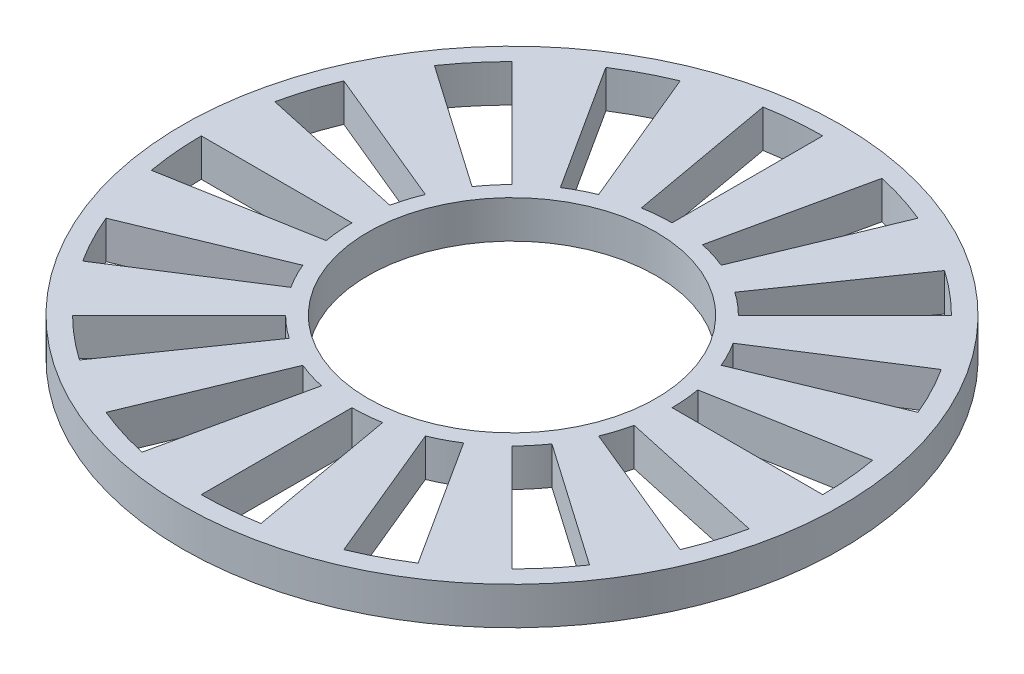
from build123d import *

# Parameters (mm, degrees)
SKETCH3_R           = 17.5
SKETCH3_R_2         = 7.65
BOSS_EXTRUDE2_DEPTH = 2
CUT_EXTRUDE1_DEPTH  = 10
CIRPATTERN1_COUNT   = 16


with BuildPart() as part:
    # Sketch3 → Boss-Extrude2 (new body)
    with BuildSketch(Plane(origin=(0, 0, 0), x_dir=(1, 0, 0), z_dir=(0, 1, 0))):
        with Locations(Location((0, 0, 0), (0, 0, 270))):
            Circle(SKETCH3_R)
        with Locations(Location((0, 0, 0), (0, 0, 270))):
            Circle(SKETCH3_R_2, mode=Mode.SUBTRACT)
    extrude(amount=BOSS_EXTRUDE2_DEPTH)

    # Sketch4 → Cut-Extrude1 (cut)
    with BuildSketch(Plane(origin=(0, 2, 0), x_dir=(1, 0, 0), z_dir=(0, 1, 0))):
        with BuildLine():
            Line((1.5, -8.366600265), (2.911764706, -16.241047574))
            ThreePointArc((2.911764706, -16.241047574), (1.461628378, -16.435134392), (0, -16.5))
            Line((0, -16.5), (0, -8.5))
            ThreePointArc((0, -8.5), (0.752960074, -8.466584384), (1.5, -8.366600265))
        make_face()
    cut_extrude1 = extrude(amount=-CUT_EXTRUDE1_DEPTH, mode=Mode.SUBTRACT)

    # CirPattern1: Cut-Extrude1 ×16 about axis
    cirpattern1_axis = Axis((0, 0, 0), (0, 1, 0))
    for i in range(1, CIRPATTERN1_COUNT):
        add(cut_extrude1.rotate(cirpattern1_axis, i * 360 / CIRPATTERN1_COUNT), mode=Mode.SUBTRACT)


solid = part.part
